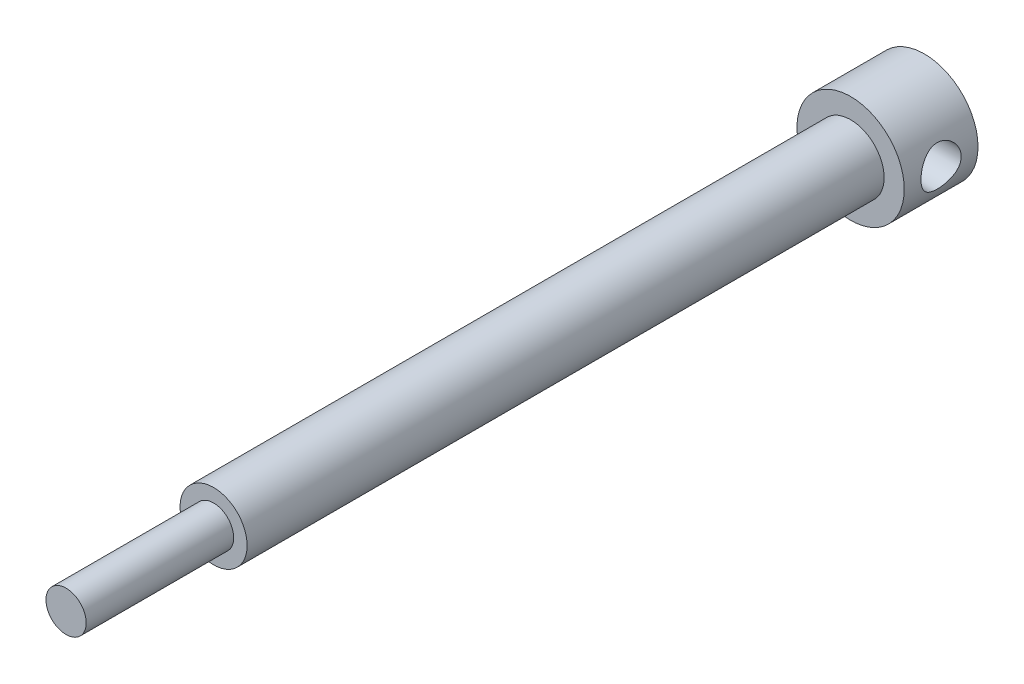
from build123d import *

# Parameters (mm, degrees)
SCHIZZO1_R                   = 8
ESTRUSIONE_ESTRUSIONE1_DEPTH = 11
SCHIZZO2_R                   = 5
ESTRUSIONE_ESTRUSIONE2_DEPTH = 95
SCHIZZO3_R                   = 3
ESTRUSIONE_ESTRUSIONE3_DEPTH = 22
SCHIZZO4_R                   = 3
TAGLIO_ESTRUSIONE1_DEPTH     = 8


with BuildPart() as part:
    # Schizzo1 → Estrusione-Estrusione1 (new body)
    with BuildSketch(Plane.XY):
        Circle(SCHIZZO1_R)
    extrude(amount=ESTRUSIONE_ESTRUSIONE1_DEPTH)

    # Schizzo2 → Estrusione-Estrusione2 (add)
    with BuildSketch(Plane.XY.offset(11)):
        Circle(SCHIZZO2_R)
    extrude(amount=ESTRUSIONE_ESTRUSIONE2_DEPTH)

    # Schizzo3 → Estrusione-Estrusione3 (add)
    with BuildSketch(Plane.XY.offset(106)):
        Circle(SCHIZZO3_R)
    extrude(amount=ESTRUSIONE_ESTRUSIONE3_DEPTH)

    # Schizzo4 → Taglio-Estrusione1 (cut, symmetric)
    with BuildSketch(Plane(origin=(0, 0, 0), x_dir=(0, 0, -1), z_dir=(1, 0, 0))):
        with Locations((-5.5, 0)):
            Circle(SCHIZZO4_R)
    extrude(amount=TAGLIO_ESTRUSIONE1_DEPTH, both=True, mode=Mode.SUBTRACT)


solid = part.part
